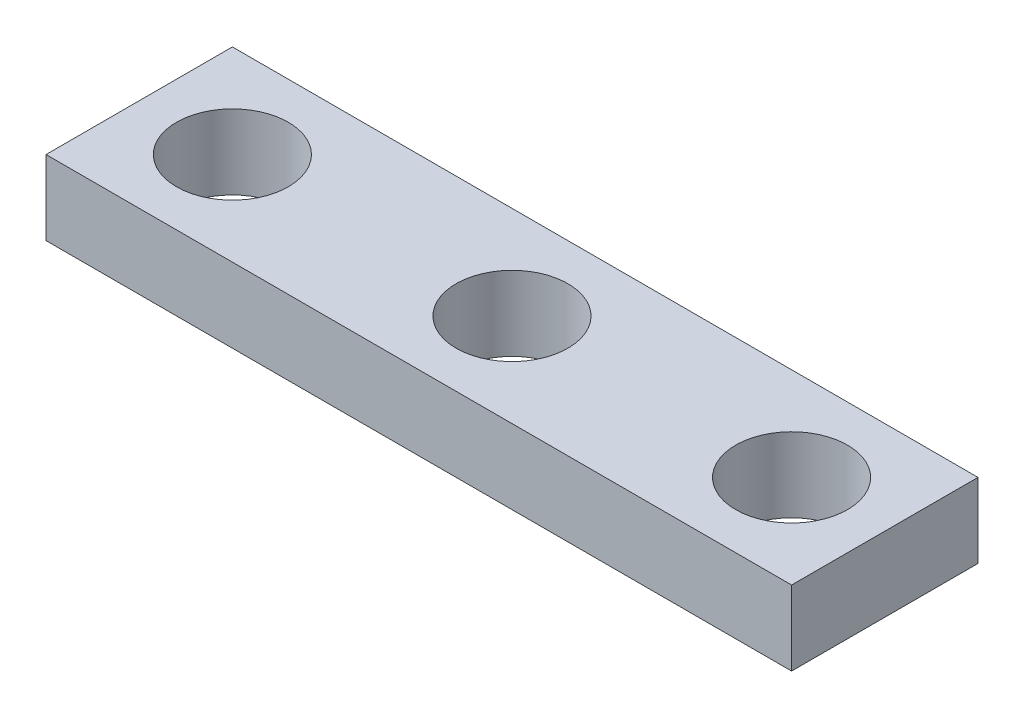
from build123d import *

# Parameters (mm, degrees)
SKETCH1_W           = 20
SKETCH1_H           = 5
SKETCH1_R           = 1.5
BOSS_EXTRUDE1_DEPTH = 2


with BuildPart() as part:
    # Sketch1 → Boss-Extrude1 (new body)
    with BuildSketch(Plane(origin=(0, 0, 0), x_dir=(1, 0, 0), z_dir=(0, 1, 0))):
        Rectangle(SKETCH1_W, SKETCH1_H)
        with Locations(Location((-7.5, 0, 0), (0, 0, 270))):
            Circle(SKETCH1_R, mode=Mode.SUBTRACT)
        with Locations(Location((7.5, 0, 0), (0, 0, 270))):
            Circle(SKETCH1_R, mode=Mode.SUBTRACT)
        with Locations(Location((0, 0, 0), (0, 0, 270))):
            Circle(SKETCH1_R, mode=Mode.SUBTRACT)
    extrude(amount=BOSS_EXTRUDE1_DEPTH)


solid = part.part
